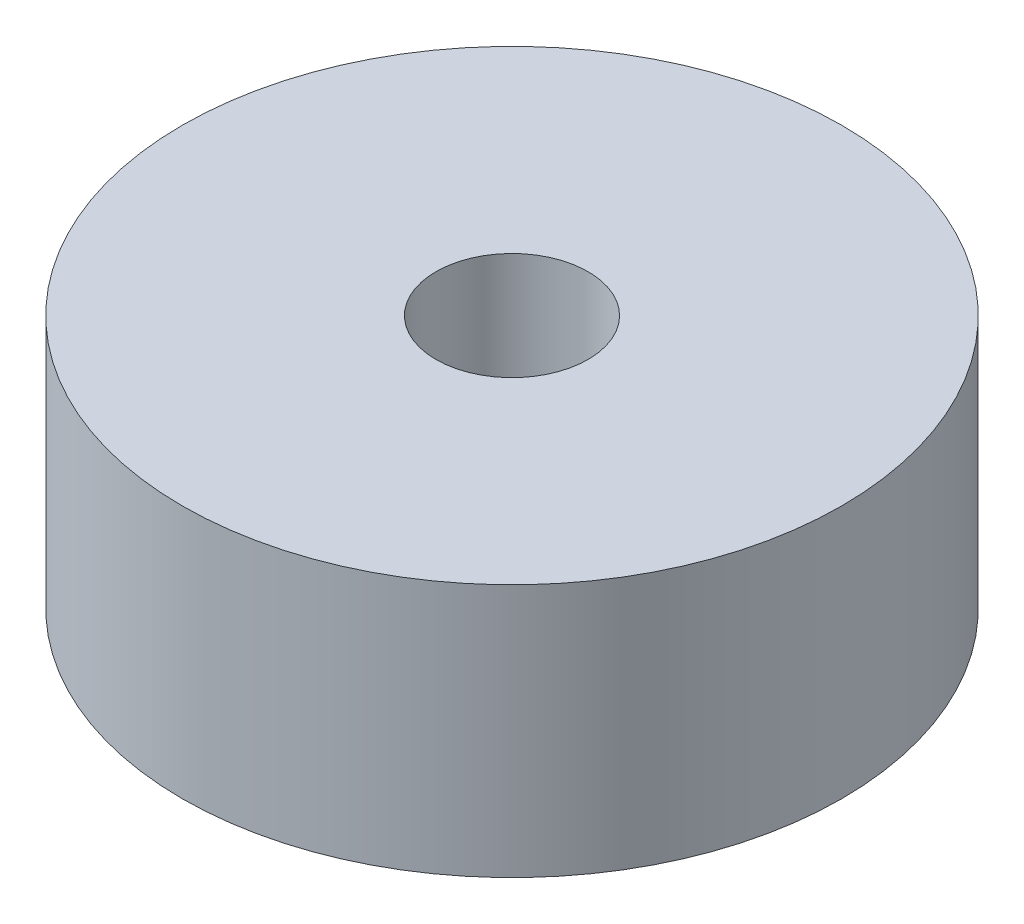
from build123d import *

# Parameters (mm, degrees)
SKETCH_1_R      = 6.5
SKETCH_1_R_2    = 1.5
EXTRUDE_2_DEPTH = 5


with BuildPart() as part:
    # Эскиз1 → Бобышка-Вытянуть2 (new body)
    with BuildSketch(Plane(origin=(0, 0, 0), x_dir=(1, 0, 0), z_dir=(0, 1, 0))):
        with Locations(Location((0, 0, 0), (0, 0, 270))):
            Circle(SKETCH_1_R)
        with Locations(Location((0, 0, 0), (0, 0, 270))):
            Circle(SKETCH_1_R_2, mode=Mode.SUBTRACT)
    extrude(amount=-EXTRUDE_2_DEPTH)


solid = part.part
